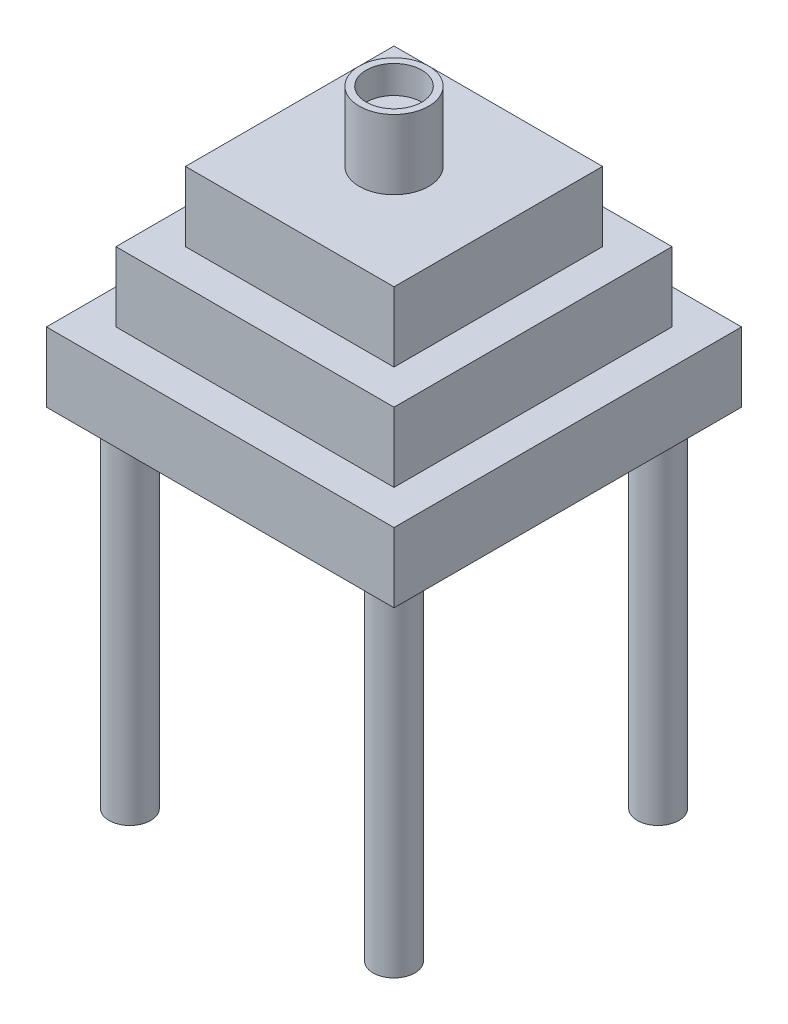
from build123d import *

# Parameters (mm, degrees)
SKETCH1_R             = 30
BOSS_EXTRUDE1_DEPTH   = 500
BOSS_EXTRUDE1_2_DEPTH = 500
BOSS_EXTRUDE1_3_DEPTH = 500
BOSS_EXTRUDE1_4_DEPTH = 500
SKETCH2_W             = 500
SKETCH2_H             = 500
BOSS_EXTRUDE2_DEPTH   = 100
SKETCH3_W             = 400
SKETCH3_H             = 400
BOSS_EXTRUDE3_DEPTH   = 100
SKETCH4_W             = 300
SKETCH4_H             = 300
BOSS_EXTRUDE4_DEPTH   = 100
SKETCH5_R             = 50
BOSS_EXTRUDE5_DEPTH   = 100
SKETCH6_R             = 40
CUT_EXTRUDE1_DEPTH    = 40


with BuildPart() as part:
    # Sketch1 → Boss-Extrude1 (new body)
    with BuildSketch(Plane(origin=(0, 0, 0), x_dir=(1, 0, 0), z_dir=(0, 1, 0))):
        with Locations(Location((-190, -190, 0), (0, 0, 270))):
            Circle(SKETCH1_R)
    extrude(amount=BOSS_EXTRUDE1_DEPTH)



with BuildPart() as body_2:
    # Sketch1 → Boss-Extrude1 2 (new body)
    with BuildSketch(Plane(origin=(0, 0, 0), x_dir=(1, 0, 0), z_dir=(0, 1, 0))):
        with Locations(Location((-190, 190, 0), (0, 0, 270))):
            Circle(SKETCH1_R)
    extrude(amount=BOSS_EXTRUDE1_2_DEPTH)


with BuildPart() as body_3:
    # Sketch1 → Boss-Extrude1 3 (new body)
    with BuildSketch(Plane(origin=(0, 0, 0), x_dir=(1, 0, 0), z_dir=(0, 1, 0))):
        with Locations(Location((190, 190, 0), (0, 0, 270))):
            Circle(SKETCH1_R)
    extrude(amount=BOSS_EXTRUDE1_3_DEPTH)


with BuildPart() as body_4:
    # Sketch1 → Boss-Extrude1 4 (new body)
    with BuildSketch(Plane(origin=(0, 0, 0), x_dir=(1, 0, 0), z_dir=(0, 1, 0))):
        with Locations(Location((190, -190, 0), (0, 0, 270))):
            Circle(SKETCH1_R)
    extrude(amount=BOSS_EXTRUDE1_4_DEPTH)


with BuildPart() as part_1:
    add(part.part)

    add(body_2.part)  # Boss-Extrude2 merges body 2

    add(body_3.part)  # Boss-Extrude2 merges body 3

    add(body_4.part)  # Boss-Extrude2 merges body 4
    # Sketch2 → Boss-Extrude2 (add)
    with BuildSketch(Plane(origin=(0, 500, 0), x_dir=(1, 0, 0), z_dir=(0, 1, 0))):
        Rectangle(SKETCH2_W, SKETCH2_H)
    extrude(amount=BOSS_EXTRUDE2_DEPTH)

    # Sketch3 → Boss-Extrude3 (add)
    with BuildSketch(Plane(origin=(0, 600, 0), x_dir=(1, 0, 0), z_dir=(0, 1, 0))):
        Rectangle(SKETCH3_W, SKETCH3_H)
    extrude(amount=BOSS_EXTRUDE3_DEPTH)

    # Sketch4 → Boss-Extrude4 (add)
    with BuildSketch(Plane(origin=(0, 700, 0), x_dir=(1, 0, 0), z_dir=(0, 1, 0))):
        Rectangle(SKETCH4_W, SKETCH4_H)
    extrude(amount=BOSS_EXTRUDE4_DEPTH)

    # Sketch5 → Boss-Extrude5 (add)
    with BuildSketch(Plane(origin=(0, 800, 0), x_dir=(1, 0, 0), z_dir=(0, 1, 0))):
        with Locations(Location((0, 0, 0), (0, 0, 270))):
            Circle(SKETCH5_R)
    extrude(amount=BOSS_EXTRUDE5_DEPTH)

    # Sketch6 → Cut-Extrude1 (cut)
    with BuildSketch(Plane(origin=(0, 900, 0), x_dir=(1, 0, 0), z_dir=(0, 1, 0))):
        with Locations(Location((0, 0, 0), (0, 0, 270))):
            Circle(SKETCH6_R)
    extrude(amount=-CUT_EXTRUDE1_DEPTH, mode=Mode.SUBTRACT)


solid = part_1.part
